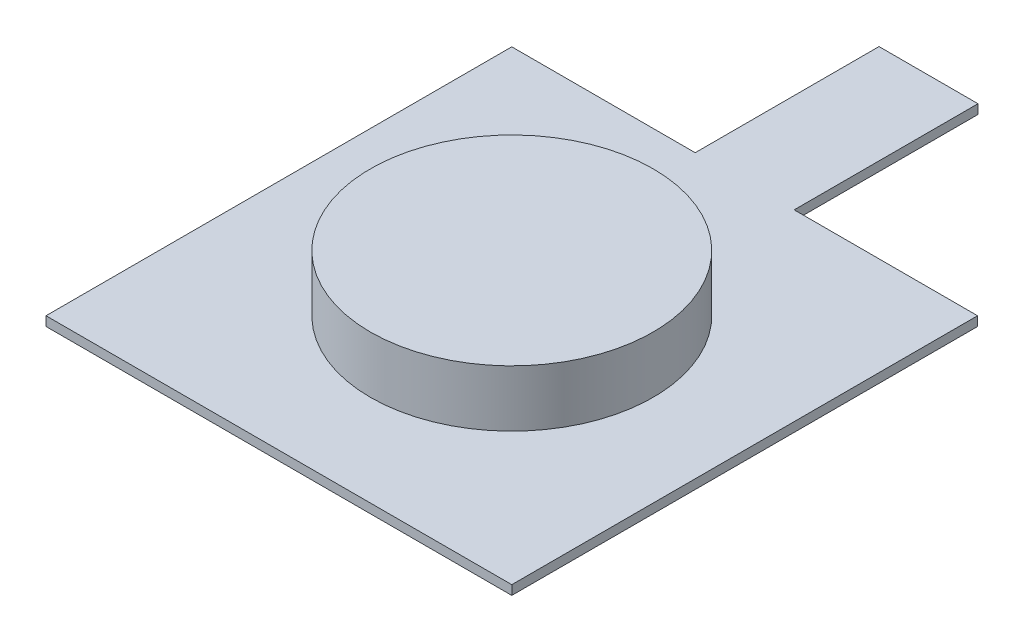
from build123d import *

# Parameters (mm, degrees)
BOSS_EXTRUDE1_DEPTH = 0.33
SKETCH2_R           = 5
BOSS_EXTRUDE3_DEPTH = 2


with BuildPart() as part:
    # Sketch1 → Boss-Extrude1 (new body)
    with BuildSketch(Plane(origin=(0, 0, 0), x_dir=(1, 0, 0), z_dir=(0, 1, 0))):
        Polygon((0, 0), (16.47, 0), (16.47, 16.47), (9.985, 16.47), (9.985, 22.97), (6.485, 22.97), (6.485, 16.47), (0, 16.47), align=None)
    extrude(amount=BOSS_EXTRUDE1_DEPTH)

    # Sketch2 → Boss-Extrude3 (add)
    with BuildSketch(Plane(origin=(0, 0.33, 0), x_dir=(1, 0, 0), z_dir=(0, 1, 0))):
        with Locations(Location((8.235, 8.235, 0), (0, 0, 270))):
            Circle(SKETCH2_R)
    extrude(amount=BOSS_EXTRUDE3_DEPTH)


solid = part.part
